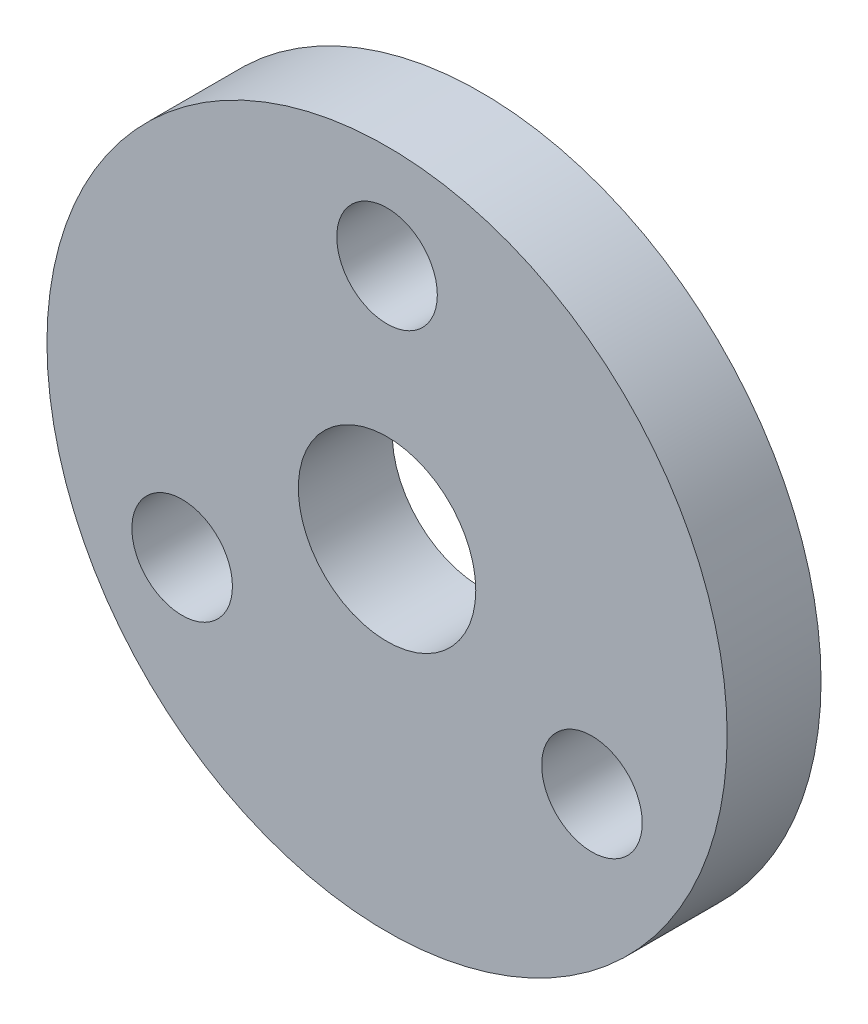
from build123d import *

# Parameters (mm, degrees)
SKETCH1_R           = 11.5
SKETCH1_R_2         = 3
SKETCH1_R_3         = 1.7
BOSS_EXTRUDE1_DEPTH = 3.175


with BuildPart() as part:
    # Sketch1 → Boss-Extrude1 (new body)
    with BuildSketch(Plane.XY):
        with Locations((10.103629711, -10.110058712)):
            Circle(SKETCH1_R)
        with Locations((10.103629711, -10.110058712)):
            Circle(SKETCH1_R_2, mode=Mode.SUBTRACT)
        with Locations((3.175426481, -14.110058712)):
            Circle(SKETCH1_R_3, mode=Mode.SUBTRACT)
        with Locations((17.031832941, -14.110058712)):
            Circle(SKETCH1_R_3, mode=Mode.SUBTRACT)
        with Locations((10.103629711, -2.110058712)):
            Circle(SKETCH1_R_3, mode=Mode.SUBTRACT)
    extrude(amount=BOSS_EXTRUDE1_DEPTH)


solid = part.part
